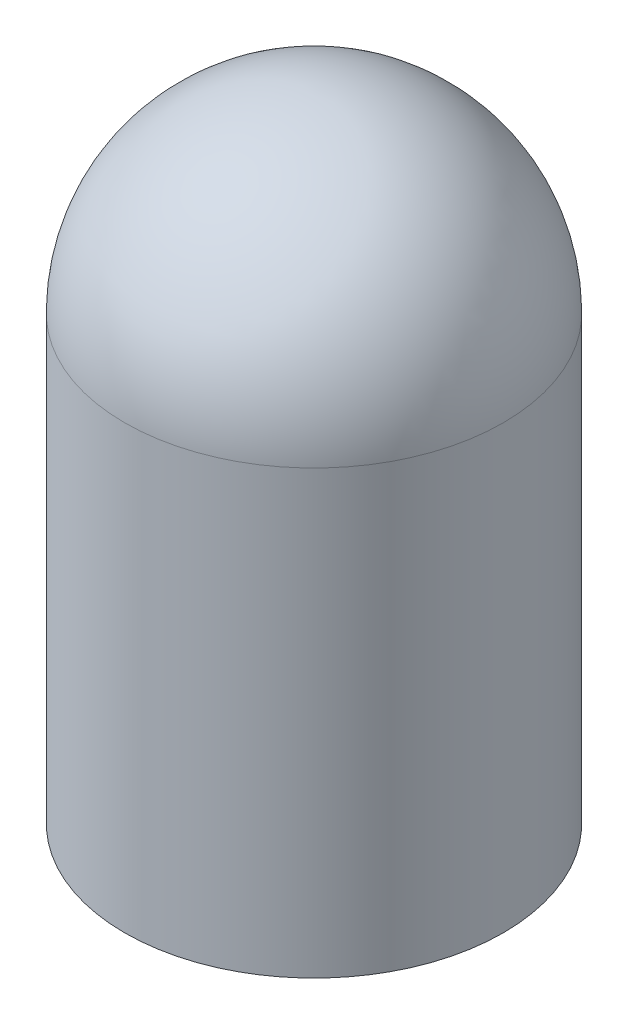
from build123d import *

# Parameters (mm, degrees)
SHELL3_T = -2


with BuildPart() as part:
    # Sketch1 → Revolve2 (revolve)
    with BuildSketch(Plane.XY, mode=Mode.PRIVATE) as revolve2_sk:
        with BuildLine():
            Line((0, 0), (60, 0))
            Line((60, 0), (60, 140))
            ThreePointArc((60, 140), (42.426406871, 182.426406871), (0, 200))
            Line((0, 200), (0, 0))
        make_face()
    revolve(revolve2_sk.sketch.rotate(Axis((0, 200, 0), (0, -1, 0)), 180), axis=Axis((0, 200, 0), (0, -1, 0)))

    # Shell3
    shell3_openings = [part.faces().sort_by_distance(p)[0] for p in [
        (0, 0, 0),
    ]]
    offset(amount=SHELL3_T, openings=shell3_openings, kind=Kind.INTERSECTION)


solid = part.part
